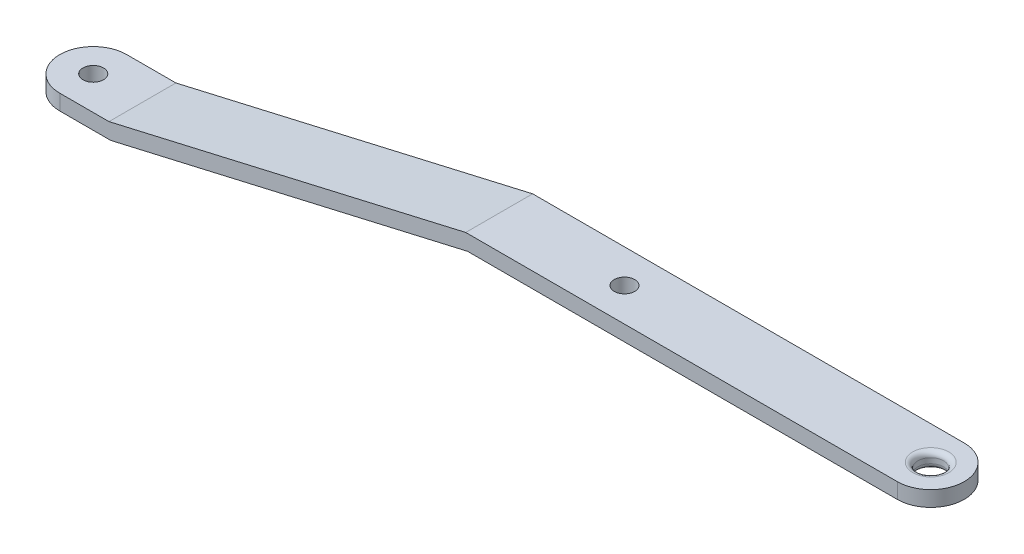
from build123d import *

# Parameters (mm, degrees)
BOSS_EXTRUDE1_DEPTH = 65
FILLET1_RADIUS      = 32.5
FILLET1_LENGTH      = 15
FILLET2_RADIUS      = 32.5
FILLET2_LENGTH      = 15
SKETCH3_R           = 10
CUT_EXTRUDE1_DEPTH  = 20
SKETCH4_R           = 10
CUT_EXTRUDE2_DEPTH  = 20
SKETCH5_R           = 12.5
CUT_EXTRUDE3_DEPTH  = 20
FILLET3_R           = 5


with BuildPart() as part:
    # Sketch1 → Boss-Extrude1 (new body)
    with BuildSketch(Plane.XY):
        Polygon((-82, 0), (0, 0), (346.518069943, 80), (796.518069943, 80), (796.518069943, 95), (344.809035818, 95), (-1.709034125, 15), (-82, 15), align=None)
    extrude(amount=BOSS_EXTRUDE1_DEPTH)

    # Fillet1: full round fillet: the end face becomes a half cylinder, R = half its width
    fillet1_face = Plane((-82, 7.5, 32.5), x_dir=(0, -1, 0), z_dir=(-1, 0, 0))  # on the end face: x along it, z out of the body
    fillet1_slab = fillet1_face.offset(-FILLET1_RADIUS / 2) * Box(FILLET1_LENGTH, 2 * FILLET1_RADIUS, FILLET1_RADIUS, mode=Mode.PRIVATE)  # the body's end, R deep
    fillet1_round = Plane((-49.5, 7.5, 32.5), x_dir=(-1, 0, 0), z_dir=(0, -1, 0)) * Cylinder(FILLET1_RADIUS, FILLET1_LENGTH, mode=Mode.PRIVATE)  # its axis R under the face
    add(fillet1_slab - fillet1_round, mode=Mode.SUBTRACT)

    # Fillet2: full round fillet: the end face becomes a half cylinder, R = half its width
    fillet2_face = Plane((796.518069943, 87.5, 32.5), x_dir=(0, -1, 0), z_dir=(1, 0, 0))  # on the end face: x along it, z out of the body
    fillet2_slab = fillet2_face.offset(-FILLET2_RADIUS / 2) * Box(FILLET2_LENGTH, 2 * FILLET2_RADIUS, FILLET2_RADIUS, mode=Mode.PRIVATE)  # the body's end, R deep
    fillet2_round = Plane((764.018069943, 87.5, 32.5), x_dir=(1, 0, 0), z_dir=(0, -1, 0)) * Cylinder(FILLET2_RADIUS, FILLET2_LENGTH, mode=Mode.PRIVATE)  # its axis R under the face
    add(fillet2_slab - fillet2_round, mode=Mode.SUBTRACT)

    # Sketch3 → Cut-Extrude1 (cut)
    with BuildSketch(Plane.XZ.offset(-80)):
        with Locations(Location((466.518069943, 32.5, 0), (0, 0, 270))):
            Circle(SKETCH3_R)
    extrude(amount=-CUT_EXTRUDE1_DEPTH, mode=Mode.SUBTRACT)

    # Sketch4 → Cut-Extrude2 (cut)
    with BuildSketch(Plane.XZ):
        with Locations(Location((-49.5, 32.5, 0), (0, 0, 270))):
            Circle(SKETCH4_R)
    extrude(amount=-CUT_EXTRUDE2_DEPTH, mode=Mode.SUBTRACT)

    # Sketch5 → Cut-Extrude3 (cut)
    with BuildSketch(Plane.XZ.offset(-80)):
        with Locations(Location((764.018069943, 32.5, 0), (0, 0, 270))):
            Circle(SKETCH5_R)
    extrude(amount=-CUT_EXTRUDE3_DEPTH, mode=Mode.SUBTRACT)

    # Fillet3
    fillet3_edges = [part.edges().sort_by_distance(p)[0] for p in [
        (764.018069943, 95, 45),
        (764.018069943, 80, 45),
    ]]
    fillet(fillet3_edges, radius=FILLET3_R)


solid = part.part
